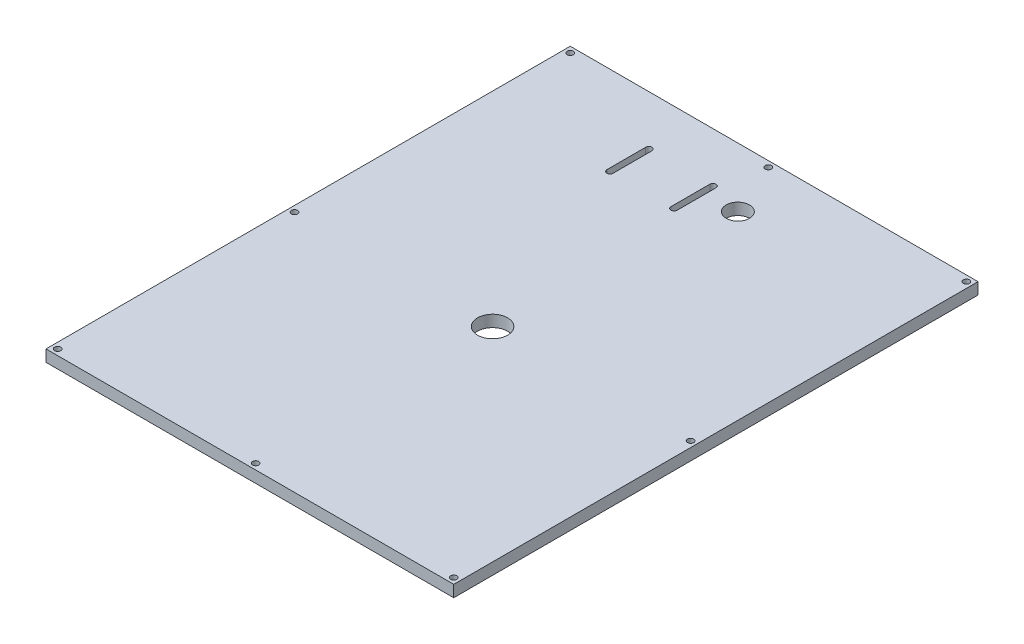
from build123d import *

# Parameters (mm, degrees)
SKETCH1_W                                         = 150
SKETCH1_H                                         = 250
SKETCH1_R                                         = 1.75
BOSS_EXTRUDE1_DEPTH                               = 6
SKETCH2_R                                         = 11.25
CUT_EXTRUDE1_DEPTH                                = 6
CSK_FOR_M3_FLAT_HEAD_MACHINE_SCREW1_D             = 3.4
CSK_FOR_M3_FLAT_HEAD_MACHINE_SCREW1_CSINK_D       = 6.3
CSK_FOR_M3_FLAT_HEAD_MACHINE_SCREW1_CSINK_ANGLE   = 90
SKETCH5_W                                         = 150
SKETCH5_H                                         = 20
BOSS_EXTRUDE2_DEPTH                               = 6
CUT_EXTRUDE2_DEPTH                                = 22
SKETCH7_R                                         = 6
CUT_EXTRUDE3_DEPTH                                = 16
SKETCH8_W                                         = 30
SKETCH8_H                                         = 270
BOSS_EXTRUDE3_DEPTH                               = 6
SKETCH9_R                                         = 1.6
CUT_EXTRUDE4_DEPTH                                = 10
SKETCH10_R                                        = 1.6
CUT_EXTRUDE5_DEPTH                                = 10
CSK_FOR_M3_5_FLAT_HEAD_MACHINE_SCREW1_D           = 3.7
CSK_FOR_M3_5_FLAT_HEAD_MACHINE_SCREW1_DEPTH       = 6
CSK_FOR_M3_5_FLAT_HEAD_MACHINE_SCREW1_CSINK_D     = 8.2
CSK_FOR_M3_5_FLAT_HEAD_MACHINE_SCREW1_CSINK_ANGLE = 90
CSK_FOR_M3_5_FLAT_HEAD_MACHINE_SCREW1_TIP         = 1.111592145
SKETCH14_W                                        = 49.124994694
SKETCH14_H                                        = 58.099415668
BOSS_EXTRUDE4_DEPTH                               = 6
SKETCH15_R                                        = 7.75
CUT_EXTRUDE6_DEPTH                                = 10
CUT_EXTRUDE7_START                                = -10
CUT_EXTRUDE7_DEPTH                                = 10


with BuildPart() as part:
    # Sketch1 → Boss-Extrude1 (new body)
    with BuildSketch(Plane(origin=(0, 0, 0), x_dir=(1, 0, 0), z_dir=(0, 1, 0))):
        Rectangle(SKETCH1_W, SKETCH1_H)
        with Locations(Location((-9.899494937, 9.899494937, 0), (0, 0, 270))):
            Circle(SKETCH1_R, mode=Mode.SUBTRACT)
        with Locations(Location((9.899494937, 9.899494937, 0), (0, 0, 270))):
            Circle(SKETCH1_R, mode=Mode.SUBTRACT)
        with Locations(Location((-9.899494937, -9.899494937, 0), (0, 0, 270))):
            Circle(SKETCH1_R, mode=Mode.SUBTRACT)
        with Locations(Location((9.899494937, -9.899494937, 0), (0, 0, 270))):
            Circle(SKETCH1_R, mode=Mode.SUBTRACT)
    extrude(amount=BOSS_EXTRUDE1_DEPTH)

    # Sketch2 → Cut-Extrude1 (cut)
    with BuildSketch(Plane(origin=(0, 6, 0), x_dir=(1, 0, 0), z_dir=(0, 1, 0))):
        with Locations(Location((0, 0, 0), (0, 0, 270))):
            Circle(SKETCH2_R)
    extrude(amount=-CUT_EXTRUDE1_DEPTH, mode=Mode.SUBTRACT)

    # CSK for M3 Flat Head Machine Screw1 (through all)
    with Locations(Plane(origin=(0, 6, 0), x_dir=(1, 0, 0), z_dir=(0, 1, 0))):
        with Locations((-9.899494937, 9.899494937), (9.899494937, 9.899494937), (-9.899494937, -9.899494937), (9.899494937, -9.899494937)):
            CounterSinkHole(CSK_FOR_M3_FLAT_HEAD_MACHINE_SCREW1_D / 2, CSK_FOR_M3_FLAT_HEAD_MACHINE_SCREW1_CSINK_D / 2, counter_sink_angle=CSK_FOR_M3_FLAT_HEAD_MACHINE_SCREW1_CSINK_ANGLE)

    # Sketch5 → Boss-Extrude2 (add)
    with BuildSketch(Plane(origin=(0, 6, 0), x_dir=(1, 0, 0), z_dir=(0, 1, 0))):
        with Locations((0, 135)):
            Rectangle(SKETCH5_W, SKETCH5_H)
    extrude(amount=-BOSS_EXTRUDE2_DEPTH)

    # Sketch6 → Cut-Extrude2 (cut)
    with BuildSketch(Plane(origin=(0, 6, 0), x_dir=(1, 0, 0), z_dir=(0, 1, 0))):
        with BuildLine():
            Line((-37.319349673, 119.387337557), (-37.319349673, 109.387337557))
            ThreePointArc((-37.319349673, 109.387337557), (-38.919349673, 107.787337557), (-40.519349673, 109.387337557))
            Line((-40.519349673, 109.387337557), (-40.519349673, 119.387337557))
            ThreePointArc((-40.519349673, 119.387337557), (-38.919349673, 120.987337557), (-37.319349673, 119.387337557))
        make_face()
        with BuildLine():
            Line((-7.519349673, 119.387337557), (-7.519349673, 109.387337557))
            ThreePointArc((-7.519349673, 109.387337557), (-5.919349673, 107.787337557), (-4.319349673, 109.387337557))
            Line((-4.319349673, 109.387337557), (-4.319349673, 119.387337557))
            ThreePointArc((-4.319349673, 119.387337557), (-5.919349673, 120.987337557), (-7.519349673, 119.387337557))
        make_face()
    extrude(amount=-CUT_EXTRUDE2_DEPTH, mode=Mode.SUBTRACT)

    # Sketch7 → Cut-Extrude3 (cut)
    with BuildSketch(Plane(origin=(0, 6, 0), x_dir=(-1, 0, 0), z_dir=(0, 1, 0))):
        with Locations(Location((-11.927460167, -114.387337557, 0), (0, 0, 90))):
            Circle(SKETCH7_R)
    extrude(amount=-CUT_EXTRUDE3_DEPTH, mode=Mode.SUBTRACT)

    # Sketch8 → Boss-Extrude3 (add)
    with BuildSketch(Plane(origin=(0, 6, 0), x_dir=(1, 0, 0), z_dir=(0, 1, 0))):
        with Locations((-90, 10)):
            Rectangle(SKETCH8_W, SKETCH8_H)
        with Locations((90, 10)):
            Rectangle(SKETCH8_W, SKETCH8_H)
    extrude(amount=-BOSS_EXTRUDE3_DEPTH)

    # Sketch9 → Cut-Extrude4 (cut)
    with BuildSketch(Plane(origin=(0, 6, 0), x_dir=(1, 0, 0), z_dir=(0, 1, 0))):
        with Locations(Location((-102, 142, 0), (0, 0, 270))):
            Circle(SKETCH9_R)
        with Locations(Location((0, 142, 0), (0, 0, 270))):
            Circle(SKETCH9_R)
        with Locations(Location((102, 142, 0), (0, 0, 270))):
            Circle(SKETCH9_R)
        with Locations(Location((-102, 0, 0), (0, 0, 270))):
            Circle(SKETCH9_R)
        with Locations(Location((102, 0, 0), (0, 0, 270))):
            Circle(SKETCH9_R)
        with Locations(Location((-102, -122, 0), (0, 0, 270))):
            Circle(SKETCH9_R)
        with Locations(Location((102, -122, 0), (0, 0, 270))):
            Circle(SKETCH9_R)
        with Locations(Location((0, -122, 0), (0, 0, 270))):
            Circle(SKETCH9_R)
    extrude(amount=-CUT_EXTRUDE4_DEPTH, mode=Mode.SUBTRACT)

    # Sketch10 → Cut-Extrude5 (cut)
    with BuildSketch(Plane(origin=(0, 6, 0), x_dir=(1, 0, 0), z_dir=(0, 1, 0))):
        with Locations(Location((-15.5, 15.5, 0), (0, 0, 270))):
            Circle(SKETCH10_R)
        with Locations(Location((-15.5, -15.5, 0), (0, 0, 270))):
            Circle(SKETCH10_R)
        with Locations(Location((15.5, 15.5, 0), (0, 0, 270))):
            Circle(SKETCH10_R)
        with Locations(Location((15.5, -15.5, 0), (0, 0, 270))):
            Circle(SKETCH10_R)
    extrude(amount=-CUT_EXTRUDE5_DEPTH, mode=Mode.SUBTRACT)

    # CSK for M3.5 Flat Head Machine Screw1
    with Locations(Plane(origin=(0, 6, 0), x_dir=(1, 0, 0), z_dir=(0, 1, 0))):
        with Locations((-15.5, 15.5), (-15.5, -15.5), (15.5, -15.5), (15.5, 15.5)):
            CounterSinkHole(CSK_FOR_M3_5_FLAT_HEAD_MACHINE_SCREW1_D / 2, CSK_FOR_M3_5_FLAT_HEAD_MACHINE_SCREW1_CSINK_D / 2, depth=CSK_FOR_M3_5_FLAT_HEAD_MACHINE_SCREW1_DEPTH, counter_sink_angle=CSK_FOR_M3_5_FLAT_HEAD_MACHINE_SCREW1_CSINK_ANGLE)
            with Locations((0, 0, -(CSK_FOR_M3_5_FLAT_HEAD_MACHINE_SCREW1_DEPTH + CSK_FOR_M3_5_FLAT_HEAD_MACHINE_SCREW1_TIP / 2))):  # 118° drill point
                Cone(0, CSK_FOR_M3_5_FLAT_HEAD_MACHINE_SCREW1_D / 2, CSK_FOR_M3_5_FLAT_HEAD_MACHINE_SCREW1_TIP, mode=Mode.SUBTRACT)

    # Sketch14 → Boss-Extrude4 (add)
    with BuildSketch(Plane.XZ):
        Rectangle(SKETCH14_W, SKETCH14_H)
    extrude(amount=-BOSS_EXTRUDE4_DEPTH)

    # Sketch15 → Cut-Extrude6 (cut)
    with BuildSketch(Plane.XZ):
        with Locations(Location((0, 0, 0), (0, 0, 270))):
            Circle(SKETCH15_R)
    extrude(amount=-CUT_EXTRUDE6_DEPTH, mode=Mode.SUBTRACT)

    # Sketch17 → Cut-Extrude7 (cut)
    with BuildSketch(Plane.XZ.offset(CUT_EXTRUDE7_START)):
        with BuildLine():
            Line((-40.519349673, -119.387337557), (-40.519349673, -99.387337557))
            ThreePointArc((-40.519349673, -99.387337557), (-38.919349673, -97.787337557), (-37.319349673, -99.387337557))
            Line((-37.319349673, -99.387337557), (-37.319349673, -119.387337557))
            ThreePointArc((-37.319349673, -119.387337557), (-38.919349673, -120.987337557), (-40.519349673, -119.387337557))
        make_face()
        with BuildLine():
            Line((-7.519349673, -119.387337557), (-7.519349673, -99.387337557))
            ThreePointArc((-7.519349673, -99.387337557), (-5.919349673, -97.787337557), (-4.319349673, -99.387337557))
            Line((-4.319349673, -99.387337557), (-4.319349673, -119.387337557))
            ThreePointArc((-4.319349673, -119.387337557), (-5.919349673, -120.987337557), (-7.519349673, -119.387337557))
        make_face()
    extrude(amount=CUT_EXTRUDE7_DEPTH, mode=Mode.SUBTRACT)


solid = part.part
